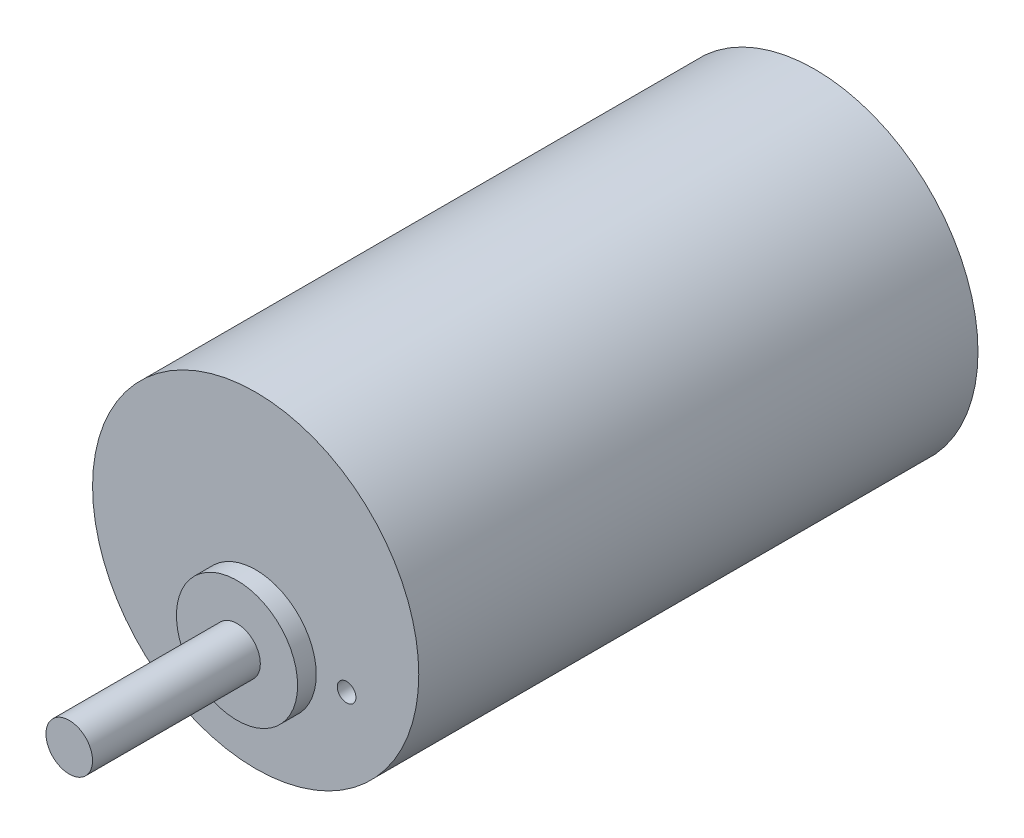
from build123d import *

# Parameters (mm, degrees)
SKETCH1_R           = 17.5
MOTOR_BASE_DEPTH    = 60
SKETCH2_R           = 2.5
SHAFT_DEPTH         = 20
SKETCH3_R           = 6.5
BOSS_EXTRUDE3_DEPTH = 2
SKETCH4_R           = 1
CUT_EXTRUDE1_DEPTH  = 2.54


with BuildPart() as part:
    # Sketch1 → Motor-Base (new body)
    with BuildSketch(Plane.XY):
        Circle(SKETCH1_R)
    extrude(amount=MOTOR_BASE_DEPTH)

    # Sketch2 → Shaft (add)
    with BuildSketch(Plane.XY.offset(60)):
        with Locations((0, -5.5)):
            Circle(SKETCH2_R)
    extrude(amount=SHAFT_DEPTH)

    # Sketch3 → Boss-Extrude3 (add)
    with BuildSketch(Plane.XY.offset(60)):
        with Locations((0, -5.5)):
            Circle(SKETCH3_R)
    extrude(amount=BOSS_EXTRUDE3_DEPTH)

    # Sketch4 → Cut-Extrude1 (cut)
    with BuildSketch(Plane.XY.offset(60)):
        with Locations((9.759593791, -5.5)):
            Circle(SKETCH4_R)
    extrude(amount=-CUT_EXTRUDE1_DEPTH, mode=Mode.SUBTRACT)


solid = part.part
